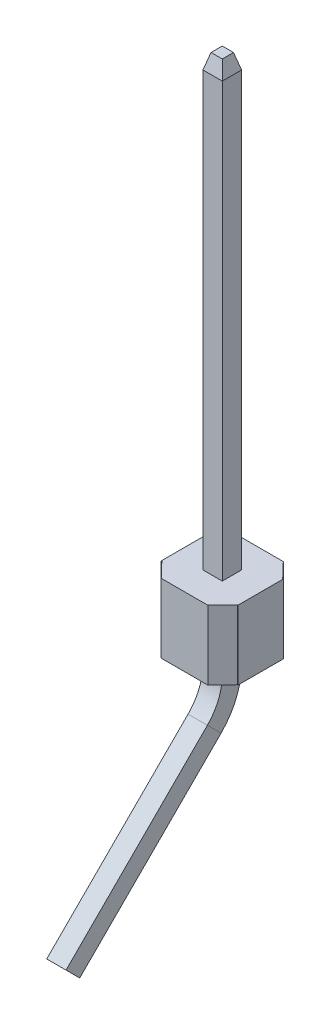
from build123d import *
from OCP.BRepFilletAPI import BRepFilletAPI_MakeChamfer

# Parameters (mm, degrees)
BOSS_EXTRUDE1_DEPTH = 2.29
SKETCH3_W           = 0.64
SKETCH3_H           = 0.64
CHAMFER3_SIZE       = 0.5
CHAMFER3_SIZE2      = 0.133974596


with BuildPart() as part:
    # Sketch1 → Boss-Extrude1 (new body)
    with BuildSketch(Plane(origin=(0, 0, 0), x_dir=(1, 0, 0), z_dir=(0, 1, 0))):
        Polygon((-0.77, 1.25), (0.77, 1.25), (1.25, 0.75), (1.27, 0.75), (1.27, -0.75), (1.25, -0.75), (0.77, -1.25), (-0.77, -1.25), (-1.25, -0.75), (-1.27, -0.75), (-1.27, 0.75), (-1.25, 0.75), align=None)
    extrude(amount=BOSS_EXTRUDE1_DEPTH)

    # Sweep1: sweep along a path in Sketch2
    with BuildLine(Plane(origin=(0, 0, 0), x_dir=(0, 0, -1), z_dir=(1, 0, 0))) as sweep1_path:
        Line((0, 17.12), (0, -0.408142235))
        ThreePointArc((0, -0.408142235), (-0.152240935, -1.1735091), (-0.585786438, -1.822355798))
        Line((-0.585786438, -1.822355798), (-5.26343064, -6.5))
    # Sketch3 → Sweep1 (sweep)
    with BuildSketch(Plane(origin=(0, 17.12, 0), x_dir=(1, 0, 0), z_dir=(0, 1, 0))):
        Rectangle(SKETCH3_W, SKETCH3_H)
    sweep(path=sweep1_path.line)

    # Chamfer3: one chamfer whose edges measure the first distance from different faces: ONE call of the kernel's chamfer builder (chamfer() names one face for all edges)
    chamfer3_edges_1 = [part.edges().sort_by_distance(p)[0] for p in [
        (0.32, 17.12, 0),
    ]]
    chamfer3_side_1 = [part.faces().sort_by_distance(p)[0] for p in [
        (0.32, 9.705, 0),
    ]]
    chamfer3_edges_2 = [part.edges().sort_by_distance(p)[0] for p in [
        (0, 17.12, -0.32),
    ]]
    chamfer3_side_2 = [part.faces().sort_by_distance(p)[0] for p in [
        (0, 9.705, -0.32),
    ]]
    chamfer3_edges_3 = [part.edges().sort_by_distance(p)[0] for p in [
        (-0.32, 17.12, 0),
    ]]
    chamfer3_side_3 = [part.faces().sort_by_distance(p)[0] for p in [
        (-0.32, 9.705, 0),
    ]]
    chamfer3_edges_4 = [part.edges().sort_by_distance(p)[0] for p in [
        (0, 17.12, 0.32),
    ]]
    chamfer3_side_4 = [part.faces().sort_by_distance(p)[0] for p in [
        (0, 9.705, 0.32),
    ]]
    chamfer3 = BRepFilletAPI_MakeChamfer(part.part.solid().wrapped)
    for e in chamfer3_edges_1:
        chamfer3.Add(CHAMFER3_SIZE, CHAMFER3_SIZE2, e.wrapped, chamfer3_side_1[0].wrapped)  # the first distance lies on this face
    for e in chamfer3_edges_2:
        chamfer3.Add(CHAMFER3_SIZE, CHAMFER3_SIZE2, e.wrapped, chamfer3_side_2[0].wrapped)  # the first distance lies on this face
    for e in chamfer3_edges_3:
        chamfer3.Add(CHAMFER3_SIZE, CHAMFER3_SIZE2, e.wrapped, chamfer3_side_3[0].wrapped)  # the first distance lies on this face
    for e in chamfer3_edges_4:
        chamfer3.Add(CHAMFER3_SIZE, CHAMFER3_SIZE2, e.wrapped, chamfer3_side_4[0].wrapped)  # the first distance lies on this face
    add(Compound.cast(chamfer3.Shape()), mode=Mode.REPLACE)


solid = part.part
